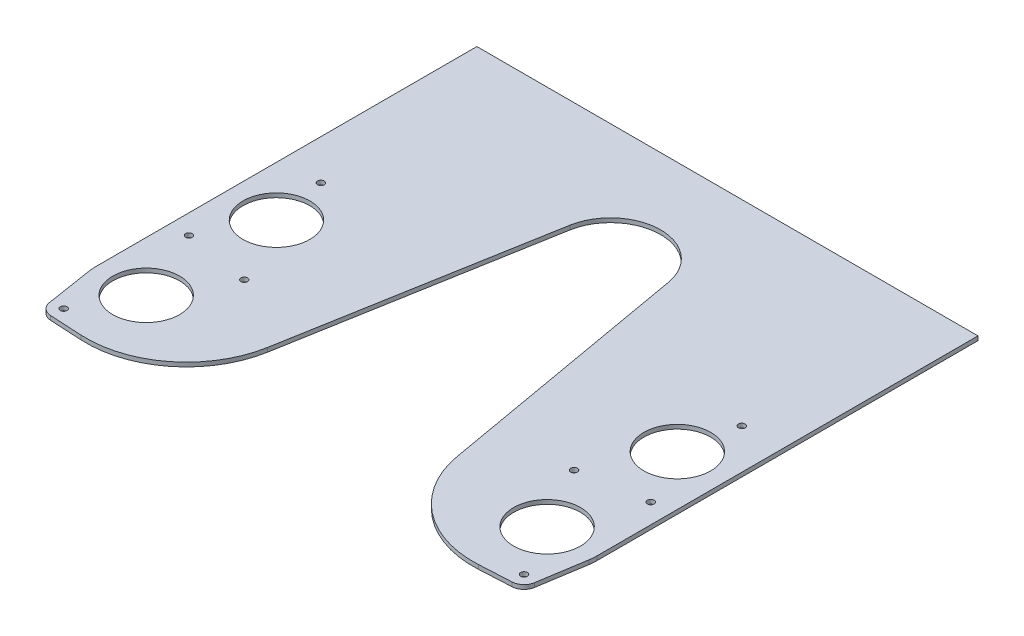
from build123d import *

# Parameters (mm, degrees)
SKETCH1_R           = 25.4
SKETCH1_R_2         = 2.5527
BOSS_EXTRUDE1_DEPTH = 3.175


with BuildPart() as part:
    # Sketch1 → Boss-Extrude1 (new body)
    with BuildSketch(Plane(origin=(0, 0, 0), x_dir=(1, 0, 0), z_dir=(0, 1, 0))):
        with BuildLine():
            Line((0, 0), (-381, 0))
            Line((-381, 0), (-381, -289.5092))
            ThreePointArc((-381, -289.5092), (-380.883021338, -292.492501864), (-380.532803674, -295.457484428))
            Line((-380.532803674, -295.457484428), (-374.89739058, -331.110855945))
            ThreePointArc((-374.89739058, -331.110855945), (-371.869518463, -336.696056706), (-366.003133246, -339.134909219))
            Line((-366.003133246, -339.134909219), (-341.613815414, -340.452811597))
            ThreePointArc((-341.613815414, -340.452811597), (-290.115080631, -324.037048347), (-262.459915955, -277.595807687))
            Line((-262.459915955, -277.595807687), (-228.02117539, -82.284004431))
            ThreePointArc((-228.02117539, -82.284004431), (-190.5, -50.8), (-152.97882461, -82.284004431))
            Line((-152.97882461, -82.284004431), (-118.540084045, -277.595807687))
            ThreePointArc((-118.540084045, -277.595807687), (-90.884919369, -324.037048347), (-39.386184586, -340.452811597))
            Line((-39.386184586, -340.452811597), (-14.996866754, -339.134909219))
            ThreePointArc((-14.996866754, -339.134909219), (-9.130481537, -336.696056706), (-6.10260942, -331.110855945))
            Line((-6.10260942, -331.110855945), (-0.467196326, -295.457484428))
            ThreePointArc((-0.467196326, -295.457484428), (-0.116978662, -292.492501864), (0, -289.5092))
            Line((0, -289.5092), (0, 0))
        make_face()
        with Locations(Location((-342.9, -190.5, 0), (0, 0, 270))):
            Circle(SKETCH1_R, mode=Mode.SUBTRACT)
        with Locations(Location((-350.506535266, -149.065461092, 0), (0, 0, 270))):
            Circle(SKETCH1_R_2, mode=Mode.SUBTRACT)
        with Locations(Location((-342.9, -289.5092, 0), (0, 0, 270))):
            Circle(SKETCH1_R, mode=Mode.SUBTRACT)
        with Locations(Location((-365.489189661, -329.623784838, 0), (0, 0, 270))):
            Circle(SKETCH1_R_2, mode=Mode.SUBTRACT)
        with Locations(Location((-366.035610617, -233.842290605, 0), (0, 0, 270))):
            Circle(SKETCH1_R_2, mode=Mode.SUBTRACT)
        with Locations(Location((-315.890976945, -241.97590689, 0), (0, 0, 270))):
            Circle(SKETCH1_R_2, mode=Mode.SUBTRACT)
        with Locations(Location((-65.109023055, -241.97590689, 0), (0, 0, 90))):
            Circle(SKETCH1_R_2, mode=Mode.SUBTRACT)
        with Locations(Location((-14.964389383, -233.842290605, 0), (0, 0, 90))):
            Circle(SKETCH1_R_2, mode=Mode.SUBTRACT)
        with Locations(Location((-15.510810339, -329.623784838, 0), (0, 0, 90))):
            Circle(SKETCH1_R_2, mode=Mode.SUBTRACT)
        with Locations(Location((-38.1, -289.5092, 0), (0, 0, 90))):
            Circle(SKETCH1_R, mode=Mode.SUBTRACT)
        with Locations(Location((-30.493464734, -149.065461092, 0), (0, 0, 90))):
            Circle(SKETCH1_R_2, mode=Mode.SUBTRACT)
        with Locations(Location((-38.1, -190.5, 0), (0, 0, 90))):
            Circle(SKETCH1_R, mode=Mode.SUBTRACT)
    extrude(amount=BOSS_EXTRUDE1_DEPTH)


solid = part.part
